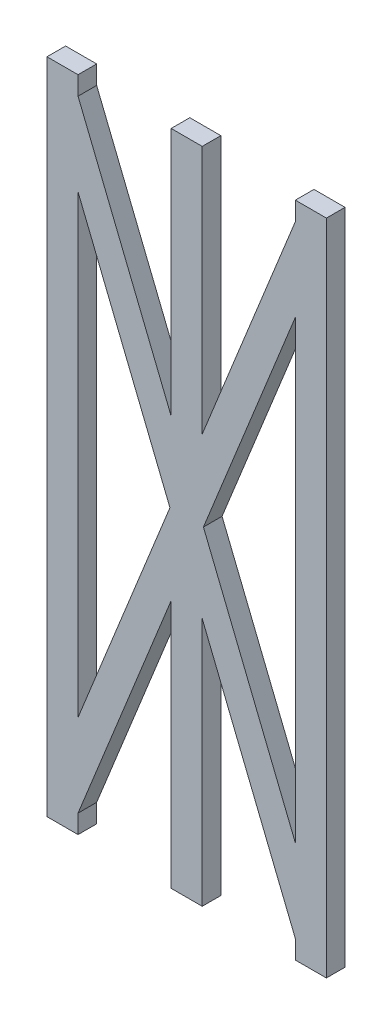
from build123d import *

# Parameters (mm, degrees)
BOSS_EXTRUDE1_DEPTH = 3


with BuildPart() as part:
    # Sketch1 → Boss-Extrude1 (new body)
    with BuildSketch(Plane.XY):
        Polygon((25, 106), (20, 106), (20, 65.864378278), (5, 103), (5, 106), (0, 106), (0, 0), (5, 0), (5, 3), (20, 40.135621722), (20, 0), (25, 0), (25, 40.135621722), (40, 3), (40, 0), (45, 0), (45, 106), (40, 106), (40, 103), (25, 65.864378278), align=None)
        Polygon((40, 16.350215981), (25.196241916, 53), (40, 89.649784019), align=None, mode=Mode.SUBTRACT)
        Polygon((19.803758084, 53), (5, 16.350215981), (5, 89.649784019), align=None, mode=Mode.SUBTRACT)
    extrude(amount=BOSS_EXTRUDE1_DEPTH)


solid = part.part
